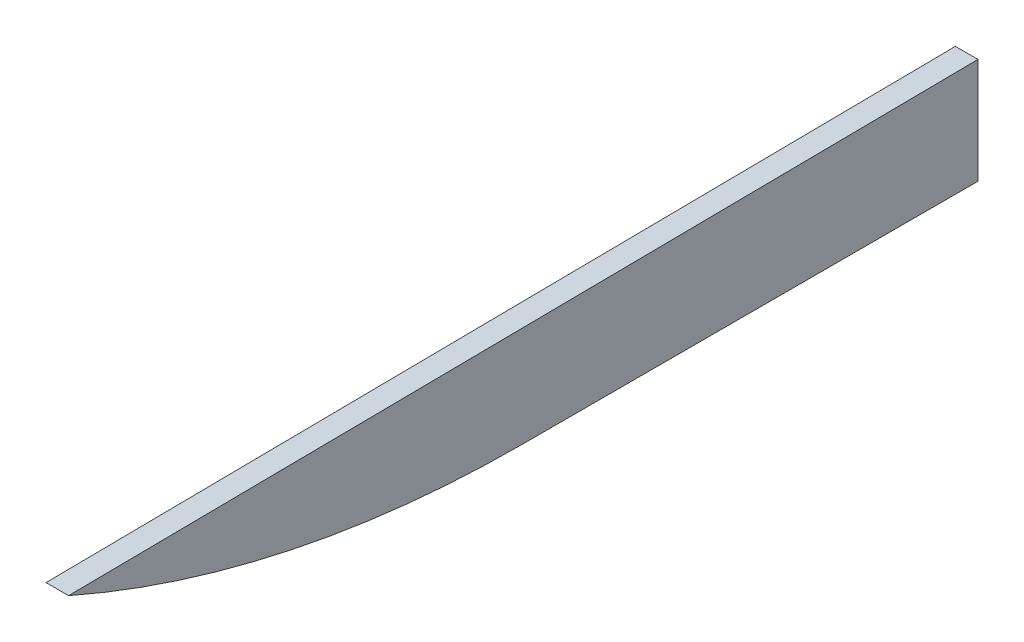
from build123d import *

# Parameters (mm, degrees)
BOSS_EXTRUDE1_DEPTH = 1.5


with BuildPart() as part:
    # Sketch1 → Boss-Extrude1 (new, symmetric)
    with BuildSketch(Plane(origin=(0, 0, 0), x_dir=(0, 0, -1), z_dir=(1, 0, 0))):
        with BuildLine():
            Line((-69.36181931, 16.141380823), (51.467945711, 17.432691289))
            Line((51.467945711, 17.432691289), (51.467945711, 3.412749088))
            Line((51.467945711, 3.412749088), (-8.946936799, 3.412749088))
            ThreePointArc((-8.946936799, 3.412749088), (-39.817538083, 6.629457572), (-69.36181931, 16.141380823))
        make_face()
    extrude(amount=BOSS_EXTRUDE1_DEPTH, both=True)


solid = part.part
